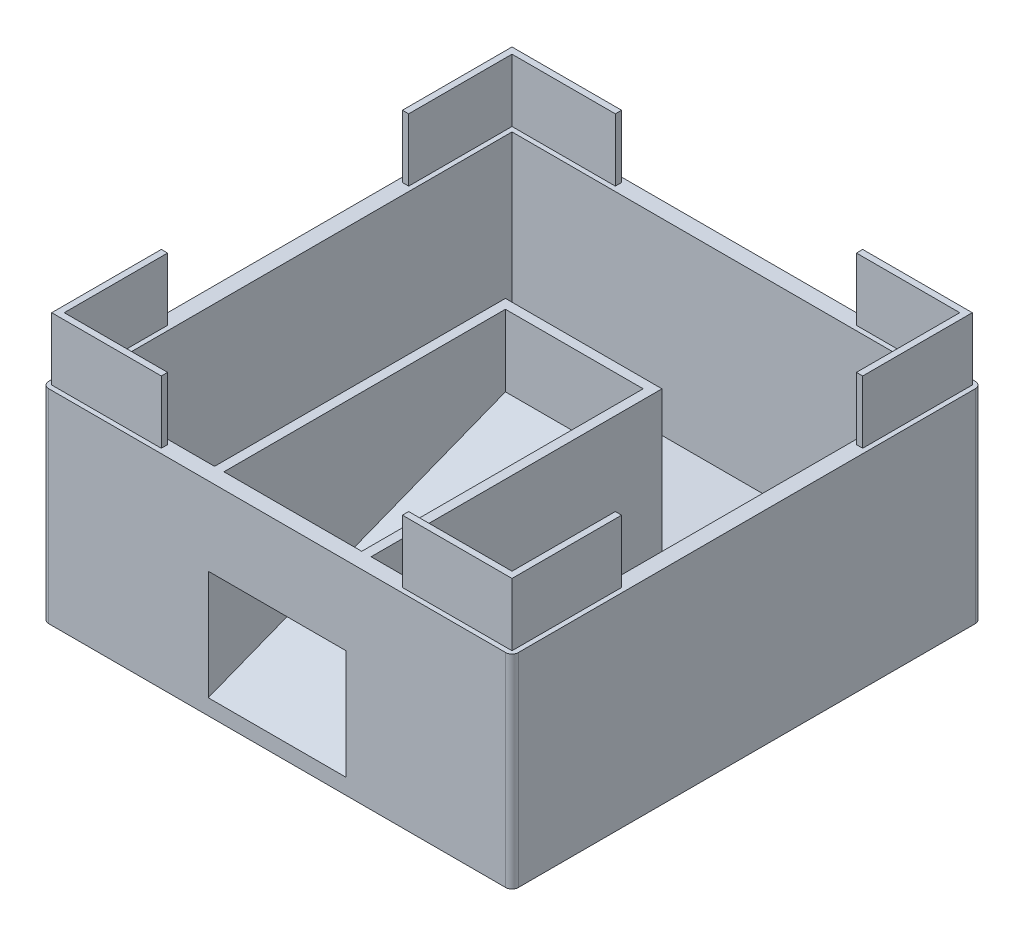
from build123d import *

# Parameters (mm, degrees)
SKETCH1_W                       = 150
SKETCH1_H                       = 150
BOSS_EXTRUDE1_DEPTH             = 65
SHELL1_T                        = -5
FILLET1_R                       = 2
BOSS_EXTRUDE2_DEPTH             = 20
CUT_EXTRUDE1_REACH              = 230.528
SKETCH3_W                       = 44
SKETCH3_H                       = 35
BOSS_EXTRUDE3_DEPTH             = 60
BOSS_EXTRUDE4_REACH             = 190.016
BOSS_EXTRUDE4_DIRECTION_2_REACH = 190.016


with BuildPart() as part:
    # Sketch1 → Boss-Extrude1 (new body)
    with BuildSketch(Plane(origin=(0, 0, 0), x_dir=(1, 0, 0), z_dir=(0, 1, 0))):
        with Locations((75, 75)):
            Rectangle(SKETCH1_W, SKETCH1_H)
    extrude(amount=BOSS_EXTRUDE1_DEPTH)

    # Shell1
    shell1_openings = [part.faces().sort_by_distance(p)[0] for p in [
        (75, 65, -75),
    ]]
    offset(amount=SHELL1_T, openings=shell1_openings, kind=Kind.INTERSECTION)

    # Fillet1
    fillet1_edges = [part.edges().sort_by_distance(p)[0] for p in [
        (0, 32.5, -150),
        (150, 32.5, -150),
        (150, 32.5, 0),
        (0, 32.5, 0),
    ]]
    fillet(fillet1_edges, radius=FILLET1_R)

    # Sketch2 → Boss-Extrude2 (add)
    with BuildSketch(Plane(origin=(0, 65, 0), x_dir=(1, 0, 0), z_dir=(0, 1, 0))):
        Polygon((1.5, 113.5), (1.5, 148.5), (36.5, 148.5), (36.5, 146.5), (3.5, 146.5), (3.5, 113.5), align=None)
        Polygon((148.5, 113.5), (148.5, 148.5), (113.5, 148.5), (113.5, 146.5), (146.5, 146.5), (146.5, 113.5), align=None)
        Polygon((148.5, 36.5), (148.5, 1.5), (113.5, 1.5), (113.5, 3.5), (146.5, 3.5), (146.5, 36.5), align=None)
        Polygon((1.5, 36.5), (1.5, 1.5), (36.5, 1.5), (36.5, 3.5), (3.5, 3.5), (3.5, 36.5), align=None)
    extrude(amount=BOSS_EXTRUDE2_DEPTH)

    # Sketch3 → Cut-Extrude1 (cut, up to next)
    with BuildSketch(Plane.XY, mode=Mode.PRIVATE) as cut_extrude1_sk1:
        with Locations((75, 22.5)):
            Rectangle(SKETCH3_W, SKETCH3_H)
    cut_extrude1_tool1 = extrude(cut_extrude1_sk1.sketch, amount=-CUT_EXTRUDE1_REACH, mode=Mode.PRIVATE) & part.part
    add(cut_extrude1_tool1.solids().sort_by_distance((75, 22.5, 0))[0], mode=Mode.SUBTRACT)

    # Sketch4 → Boss-Extrude3 (add)
    with BuildSketch(Plane(origin=(0, 5, 0), x_dir=(1, 0, 0), z_dir=(0, 1, 0))):
        Polygon((53, 5), (53, 94.9), (97, 94.9), (97, 5), (100, 5), (100, 97.9), (50, 97.9), (50, 5), align=None)
    extrude(amount=BOSS_EXTRUDE3_DEPTH)

    # Sketch7 → Boss-Extrude4 (add, up to next)
    with BuildSketch(Plane(origin=(75, 0, 0), x_dir=(0, 0, -1), z_dir=(1, 0, 0)), mode=Mode.PRIVATE) as boss_extrude4_sk1:
        Polygon((94.9, 42.158643577), (0, 5), (94.9, 5), align=None)
    boss_extrude4_tool1 = extrude(boss_extrude4_sk1.sketch, amount=BOSS_EXTRUDE4_REACH, mode=Mode.PRIVATE) - part.part
    add(boss_extrude4_tool1.solids().sort_by_distance((75, 17.386215, -63.266667))[0])

    # Sketch7 → Boss-Extrude4 direction 2 (add, up to next)
    with BuildSketch(Plane(origin=(75, 0, 0), x_dir=(0, 0, -1), z_dir=(1, 0, 0)), mode=Mode.PRIVATE) as boss_extrude4_direction_2_sk1:
        Polygon((94.9, 42.158643577), (0, 5), (94.9, 5), align=None)
    boss_extrude4_direction_2_tool1 = extrude(boss_extrude4_direction_2_sk1.sketch, amount=-BOSS_EXTRUDE4_DIRECTION_2_REACH, mode=Mode.PRIVATE) - part.part
    add(boss_extrude4_direction_2_tool1.solids().sort_by_distance((75, 17.386215, -63.266667))[0])


solid = part.part
